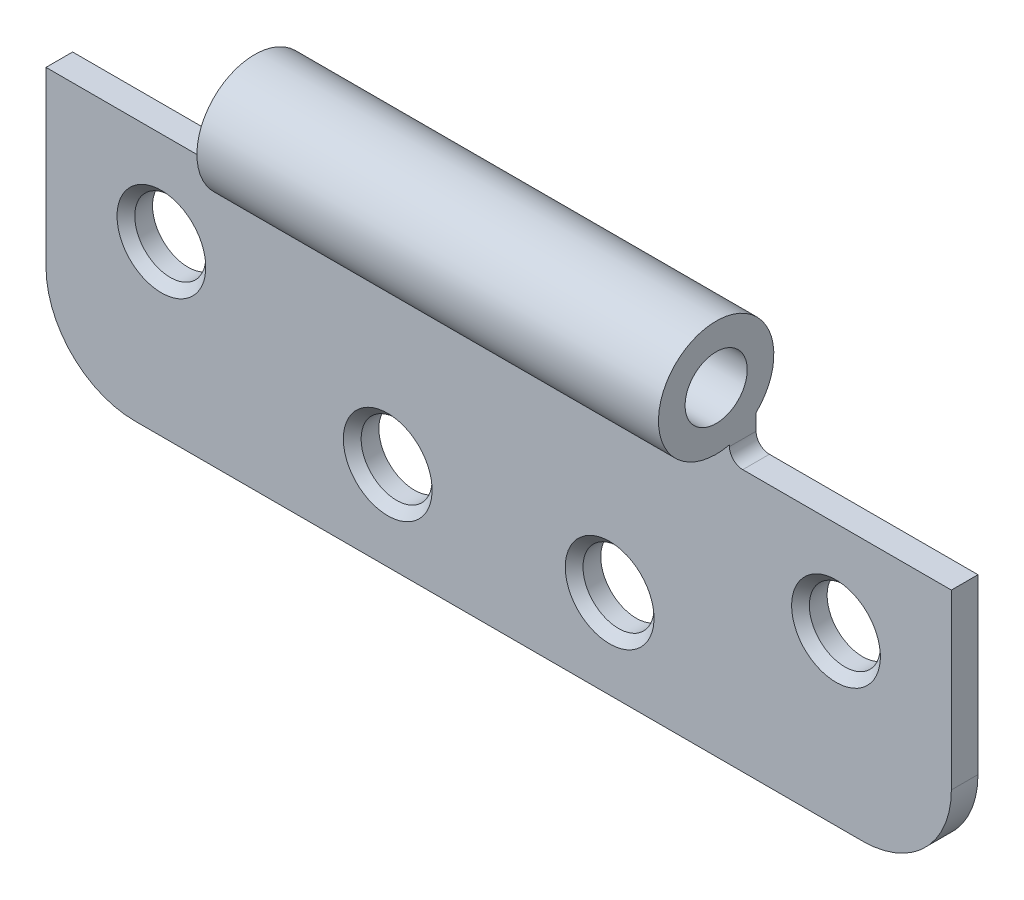
from build123d import *

# Parameters (mm, degrees)
SKETCH1_R           = 4
BOSS_EXTRUDE1_DEPTH = 3
SKETCH2_R           = 6.5
BOSS_EXTRUDE2_DEPTH = 52
SKETCH3_R           = 3.5
CUT_EXTRUDE1_DEPTH  = 90.364422451
CHAMFER1_SIZE       = 1


with BuildPart() as part:
    # Sketch1 → Boss-Extrude1 (new body)
    with BuildSketch(Plane.XY):
        with BuildLine():
            Line((27.5, 29.5), (51, 29.5))
            Line((51, 29.5), (51, 10))
            ThreePointArc((51, 10), (48.071067812, 2.928932188), (41, 0))
            Line((41, 0), (-41, 0))
            ThreePointArc((-41, 0), (-48.071067812, 2.928932188), (-51, 10))
            Line((-51, 10), (-51, 29.5))
            Line((-51, 29.5), (-27.5, 29.5))
            ThreePointArc((-27.5, 29.5), (-26.439339828, 29.939339828), (-26, 31))
            Line((-26, 31), (-26, 37.5))
            Line((-26, 37.5), (26, 37.5))
            Line((26, 37.5), (26, 31))
            ThreePointArc((26, 31), (26.439339828, 29.939339828), (27.5, 29.5))
        make_face()
        with Locations((-38, 19)):
            Circle(SKETCH1_R, mode=Mode.SUBTRACT)
        with Locations((38, 19)):
            Circle(SKETCH1_R, mode=Mode.SUBTRACT)
        with Locations((-12.5, 10)):
            Circle(SKETCH1_R, mode=Mode.SUBTRACT)
        with Locations((12.5, 10)):
            Circle(SKETCH1_R, mode=Mode.SUBTRACT)
    extrude(amount=BOSS_EXTRUDE1_DEPTH)

    # Sketch2 → Boss-Extrude2 (add)
    with BuildSketch(Plane.ZY.offset(26)):
        with Locations((4.5, 37.5)):
            Circle(SKETCH2_R)
    extrude(amount=-BOSS_EXTRUDE2_DEPTH)

    # Sketch3 → Cut-Extrude1 (cut, through all)
    with BuildSketch(Plane.ZY.offset(26)):
        with Locations((4.5, 37.5)):
            Circle(SKETCH3_R)
    extrude(amount=-CUT_EXTRUDE1_DEPTH, mode=Mode.SUBTRACT)

    # Chamfer1
    chamfer1_edges = [part.edges().sort_by_distance(p)[0] for p in [
        (-42, 19, 3),
        (34, 19, 3),
        (-16.5, 10, 3),
        (8.5, 10, 3),
    ]]
    chamfer(chamfer1_edges, length=CHAMFER1_SIZE)


solid = part.part
